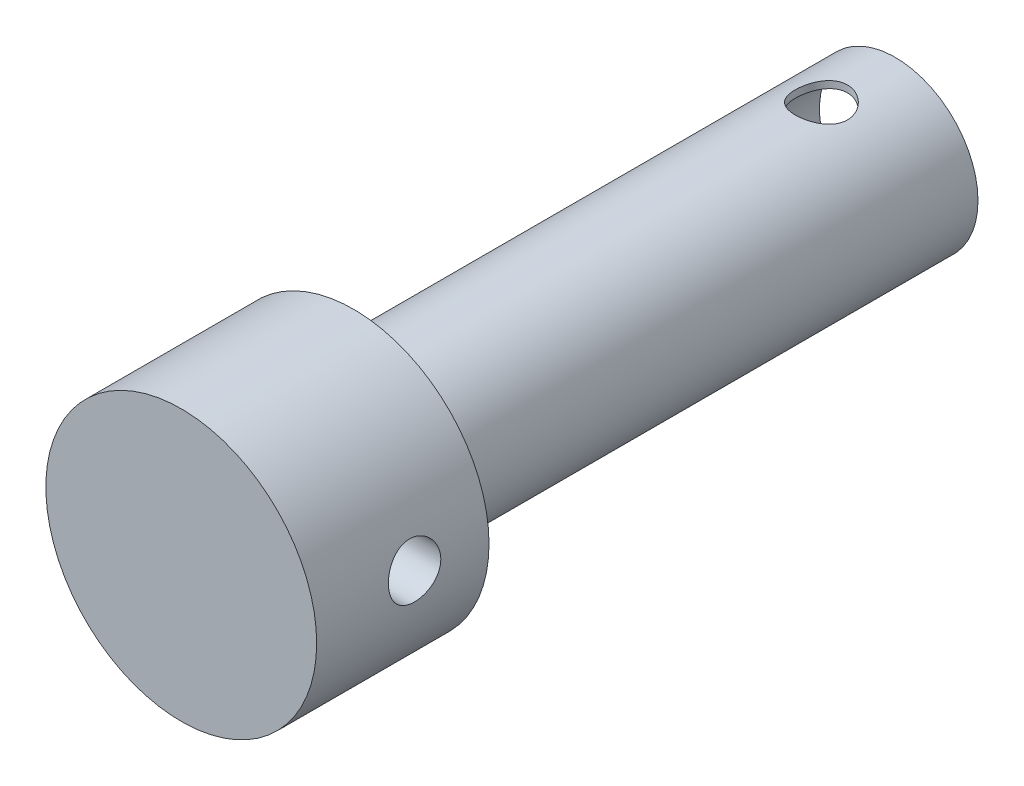
from build123d import *

# Parameters (mm, degrees)
SKETCH1_R               = 10.668
SKETCH1_R_2             = 9.779
BOSS_EXTRUDE1_DEPTH     = 88.9
SKETCH4_R               = 17.4625
BOSS_EXTRUDE2_DEPTH     = 19.05
CUT_EXTRUDE1_DEPTH      = 93.266395901
CUT_EXTRUDE1_DEPTH_BACK = 93.266395901
SKETCH5_R               = 3.3655
CUT_EXTRUDE2_DEPTH      = 93.266396035
CUT_EXTRUDE2_DEPTH_BACK = 93.266396035
SKETCH7_R               = 3.3655
SKETCH8_R               = 9.652
CUT_EXTRUDE3_DEPTH      = 93.266396035
BOSS_EXTRUDE3_START     = 3.175
SKETCH9_R               = 17.4625
BOSS_EXTRUDE3_DEPTH     = 3.175


with BuildPart() as part:
    # Sketch1 → Boss-Extrude1 (new body)
    with BuildSketch(Plane.XY):
        Circle(SKETCH1_R)
        Circle(SKETCH1_R_2, mode=Mode.SUBTRACT)
    extrude(amount=BOSS_EXTRUDE1_DEPTH)

    # Sketch4 → Boss-Extrude2 (add)
    with BuildSketch(Plane.XY.offset(88.9)):
        Circle(SKETCH4_R)
    extrude(amount=-BOSS_EXTRUDE2_DEPTH)

    # Sketch5 → Cut-Extrude1 (cut, two sides: drawn at the far end of the back side and taken through both)
    with BuildSketch(Plane(origin=(0, 0, 0), x_dir=(0, 0, -1), z_dir=(1, 0, 0)).offset(-CUT_EXTRUDE1_DEPTH_BACK)):
        with Locations(Location((-79.375, 1.5875, 0), (0, 0, 331.855418691))):
            Circle(SKETCH5_R)
    extrude(amount=CUT_EXTRUDE1_DEPTH + CUT_EXTRUDE1_DEPTH_BACK, mode=Mode.SUBTRACT)

    # Sketch7 → Cut-Extrude2 (cut, two sides: drawn at the far end of the back side and taken through both)
    with BuildSketch(Plane(origin=(0, 0, 0), x_dir=(1, 0, 0), z_dir=(0, 1, 0)).offset(-CUT_EXTRUDE2_DEPTH_BACK)):
        with Locations(Location((0, -9.525, 0), (0, 0, 270))):
            Circle(SKETCH7_R)
    extrude(amount=CUT_EXTRUDE2_DEPTH + CUT_EXTRUDE2_DEPTH_BACK, mode=Mode.SUBTRACT)

    # Sketch8 → Cut-Extrude3 (cut, through all)
    with BuildSketch(Plane.XY.offset(88.9)):
        Circle(SKETCH8_R)
    extrude(amount=-CUT_EXTRUDE3_DEPTH, mode=Mode.SUBTRACT)

    # Sketch9 → Boss-Extrude3 (add)
    with BuildSketch(Plane.XY.offset(88.9).offset(BOSS_EXTRUDE3_START)):
        Circle(SKETCH9_R)
    extrude(amount=-BOSS_EXTRUDE3_DEPTH)


solid = part.part
